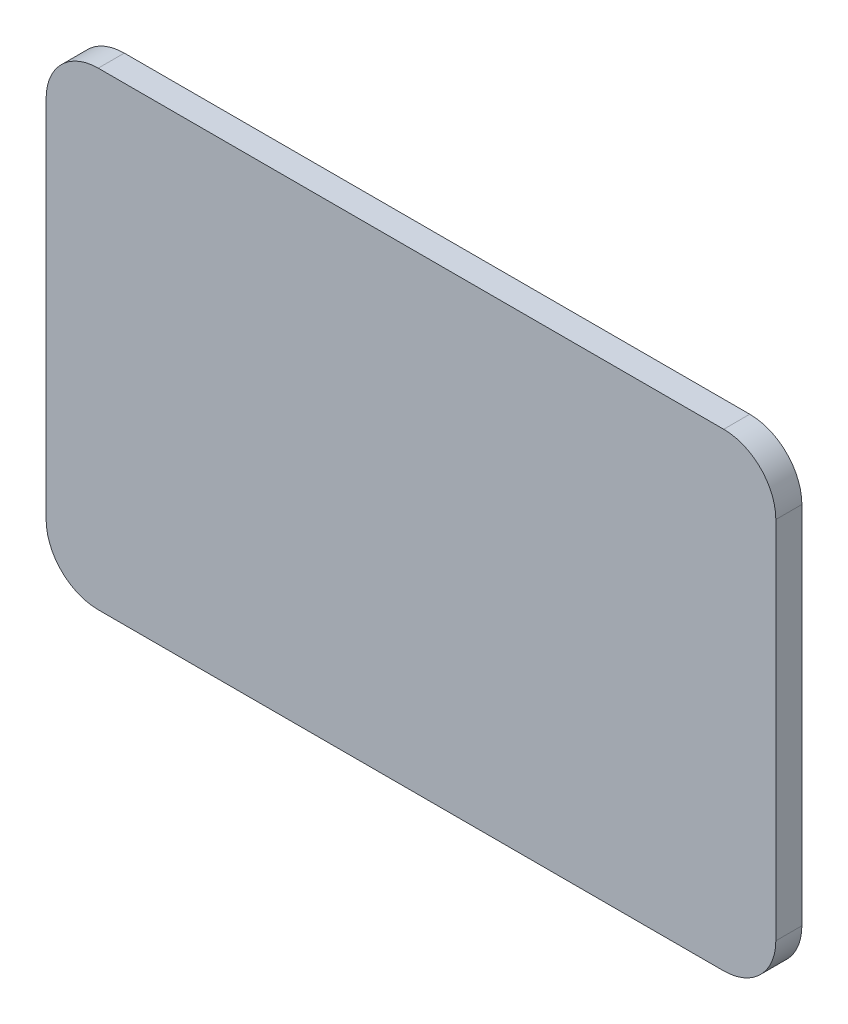
from build123d import *

# Parameters (mm, degrees)
RESSALTO_EXTRUS_O1_DEPTH = 1


with BuildPart() as part:
    # Esboço1 → Ressalto-extrusão1 (new body)
    with BuildSketch(Plane.XY):
        with BuildLine():
            Line((-11.337274581, -8.878571429), (12.662725419, -8.878571429))
            ThreePointArc((12.662725419, -8.878571429), (14.076938982, -8.292784991), (14.662725419, -6.878571429))
            Line((14.662725419, -6.878571429), (14.662725419, 7.121428571))
            ThreePointArc((14.662725419, 7.121428571), (14.076938982, 8.535642134), (12.662725419, 9.121428571))
            Line((12.662725419, 9.121428571), (-11.337274581, 9.121428571))
            ThreePointArc((-11.337274581, 9.121428571), (-12.751488143, 8.535642134), (-13.337274581, 7.121428571))
            Line((-13.337274581, 7.121428571), (-13.337274581, -6.878571429))
            ThreePointArc((-13.337274581, -6.878571429), (-12.751488143, -8.292784991), (-11.337274581, -8.878571429))
        make_face()
    extrude(amount=RESSALTO_EXTRUS_O1_DEPTH)


solid = part.part
